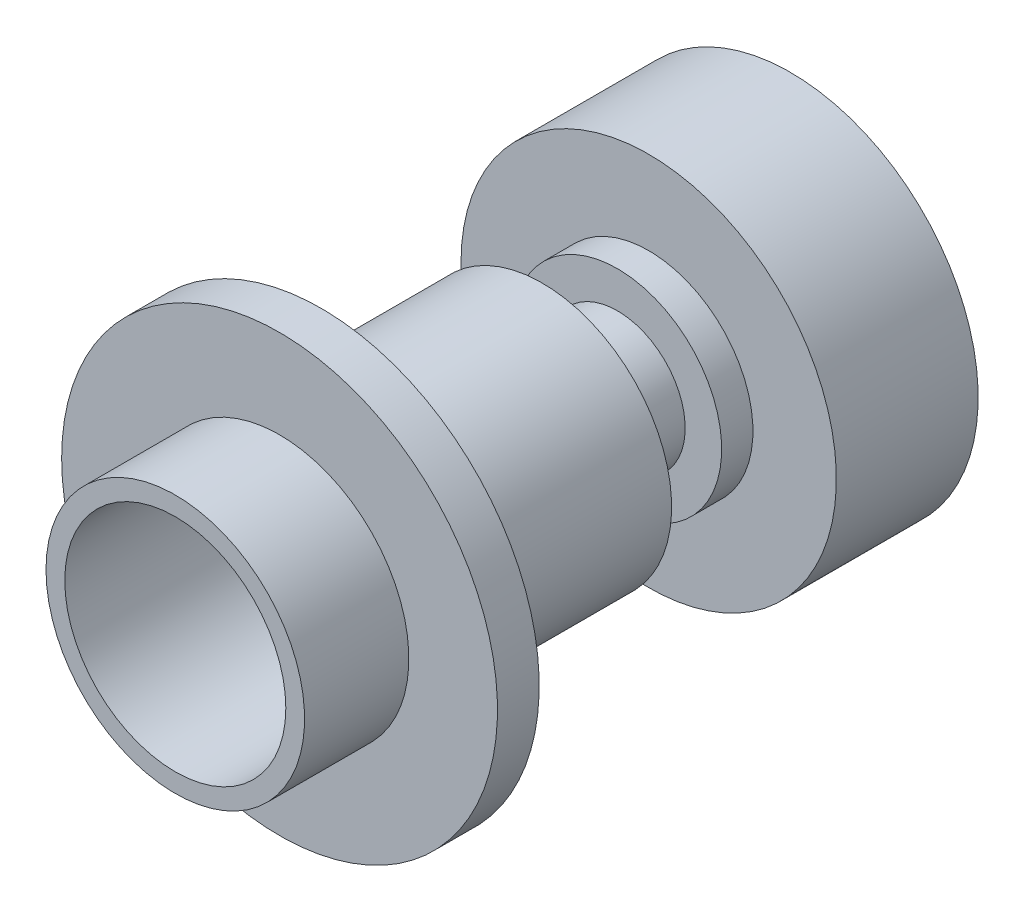
from build123d import *


with BuildPart() as part:
    # Body Sketch → Body Revolve (revolve)
    with BuildSketch(Plane(origin=(0, 0, 0), x_dir=(1, 0, 0), z_dir=(0, 1, 0)), mode=Mode.PRIVATE) as body_revolve_sk:
        Polygon((2.65, -14.75), (3.1, -14.75), (3.1, -12.25), (5.225, -12.25), (5.225, -11.25), (3.1, -11.25), (3.1, -5.95), (1.625, -5.55), (1.625, -4.15), (2.5, -4.15), (2.5, -3.4), (0.25, -3.4), (0.25, -5.954207714), (2.65, -6.605055172), align=None)
    revolve(body_revolve_sk.sketch.rotate(Axis((0, 0, 0), (0, 0, 1)), 180), axis=Axis((0, 0, 0), (0, 0, 1)))

    # N75 Sketch → N75 Revolve (revolve)
    with BuildSketch(Plane(origin=(0, 0, 0), x_dir=(1, 0, 0), z_dir=(0, 1, 0)), mode=Mode.PRIVATE) as n75_revolve_sk:
        Polygon((3.75, 0), (4.5, 0), (4.5, -3.4), (0.8, -3.4), (0.8, -2.65), (3.75, -2.65), align=None)
    revolve(n75_revolve_sk.sketch.rotate(Axis((0, 0, 0), (0, 0, 1)), 180), axis=Axis((0, 0, 0), (0, 0, 1)))


solid = part.part
